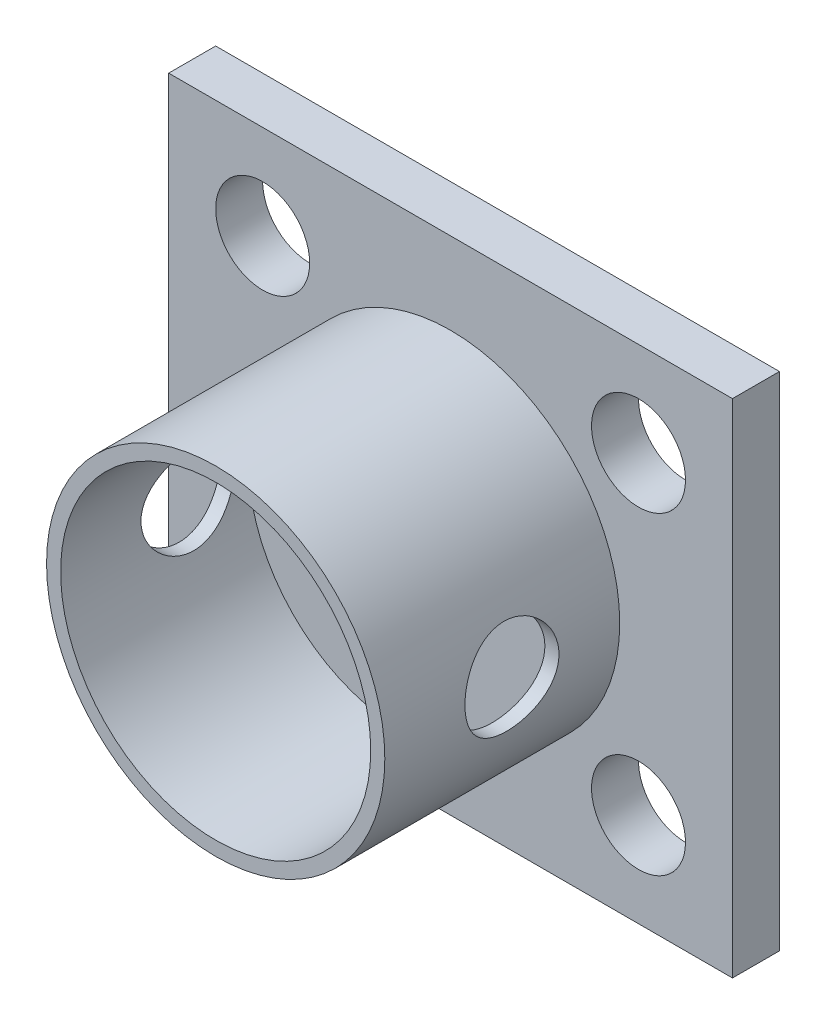
from build123d import *

# Parameters (mm, degrees)
SKETCH1_W               = 60
SKETCH1_H               = 53.4
SKETCH1_R               = 5
SKETCH1_R_2             = 18
BOSS_EXTRUDE1_DEPTH     = 5
SKETCH1_3_R             = 18
SKETCH1_3_R_2           = 16.5
BOSS_EXTRUDE2_DEPTH     = 30
SKETCH1_4_R             = 16.5
SKETCH1_4_R_2           = 2.5
BOSS_EXTRUDE3_DEPTH     = 10
CUT_EXTRUDE1_DEPTH      = 51.128734275
CUT_EXTRUDE1_DEPTH_BACK = 51.128734275
SKETCH2_R               = 5


with BuildPart() as part:
    # Sketch1 → Boss-Extrude1 (new body)
    with BuildSketch(Plane.XY):
        Rectangle(SKETCH1_W, SKETCH1_H)
        with Locations((-20, -16.7)):
            Circle(SKETCH1_R, mode=Mode.SUBTRACT)
        with Locations((20, -16.7)):
            Circle(SKETCH1_R, mode=Mode.SUBTRACT)
        with Locations((-20, 16.7)):
            Circle(SKETCH1_R, mode=Mode.SUBTRACT)
        Circle(SKETCH1_R_2, mode=Mode.SUBTRACT)
        with Locations((20, 16.7)):
            Circle(SKETCH1_R, mode=Mode.SUBTRACT)
    extrude(amount=BOSS_EXTRUDE1_DEPTH)

    # Sketch1<3> → Boss-Extrude2 (add)
    with BuildSketch(Plane.XY):
        Circle(SKETCH1_3_R)
        Circle(SKETCH1_3_R_2, mode=Mode.SUBTRACT)
    extrude(amount=BOSS_EXTRUDE2_DEPTH)

    # Sketch1<4> → Boss-Extrude3 (add)
    with BuildSketch(Plane.XY):
        Circle(SKETCH1_4_R)
        with Locations((-7.5, 0)):
            Circle(SKETCH1_4_R_2, mode=Mode.SUBTRACT)
        with Locations((7.5, 0)):
            Circle(SKETCH1_4_R_2, mode=Mode.SUBTRACT)
    extrude(amount=BOSS_EXTRUDE3_DEPTH)

    # Sketch2 → Cut-Extrude1 (cut, two sides: drawn at the far end of the back side and taken through both)
    with BuildSketch(Plane(origin=(0, 0, 0), x_dir=(0, 0, -1), z_dir=(1, 0, 0)).offset(-CUT_EXTRUDE1_DEPTH_BACK)):
        with Locations((-16.460509222, 0.48266687)):
            Circle(SKETCH2_R)
    extrude(amount=CUT_EXTRUDE1_DEPTH + CUT_EXTRUDE1_DEPTH_BACK, mode=Mode.SUBTRACT)


solid = part.part
